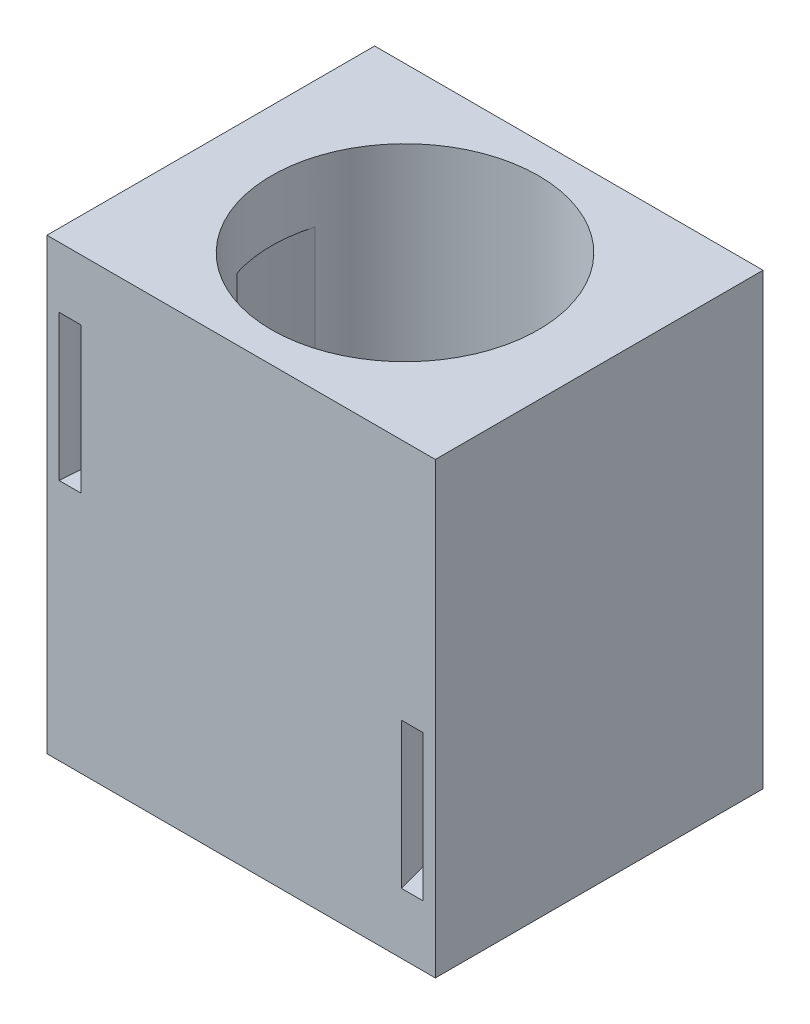
from build123d import *

# Parameters (mm, degrees)
SKETCH1_W           = 32
SKETCH1_H           = 27
SKETCH1_R           = 11
BOSS_EXTRUDE1_DEPTH = 30
CUT_EXTRUDE2_DEPTH  = 12
CIRPATTERN2_COUNT   = 2
SKETCH7_W           = 32
SKETCH7_H           = 27
SKETCH7_R           = 11
BOSS_EXTRUDE2_DEPTH = 3.5
BOSS_EXTRUDE3_START = 3.5
SKETCH8_W           = 32
SKETCH8_H           = 27
SKETCH8_R           = 11
BOSS_EXTRUDE3_DEPTH = 3.5


with BuildPart() as part:
    # Sketch1 → Boss-Extrude1 (new body)
    with BuildSketch(Plane(origin=(0, 0, 0), x_dir=(1, 0, 0), z_dir=(0, 1, 0))):
        Rectangle(SKETCH1_W, SKETCH1_H)
        Circle(SKETCH1_R, mode=Mode.SUBTRACT)
    extrude(amount=BOSS_EXTRUDE1_DEPTH)

    # Sketch4 → Cut-Extrude2 (cut)
    with BuildSketch(Plane(origin=(0, 28.5, 0), x_dir=(1, 0, 0), z_dir=(0, 1, 0))):
        with BuildLine():
            Line((-13.2, -13.5), (-8.943538475, 2.314781316))
            Line((-8.943538475, 2.314781316), (-10.541084547, 3.144127315))
            ThreePointArc((-10.541084547, 3.144127315), (-13.677421735, -4.934985855), (-15, -13.5))
            Line((-15, -13.5), (-13.2, -13.5))
        make_face()
    cut_extrude2 = extrude(amount=-CUT_EXTRUDE2_DEPTH, mode=Mode.SUBTRACT)

    # CirPattern2: Cut-Extrude2 ×2 about axis
    cirpattern2_axis = Axis((0, 15, 28.768716551), (0, 0, -1))
    for i in range(1, CIRPATTERN2_COUNT):
        add(cut_extrude2.rotate(cirpattern2_axis, i * 360 / CIRPATTERN2_COUNT), mode=Mode.SUBTRACT)

    # Sketch7 → Boss-Extrude2 (add)
    with BuildSketch(Plane(origin=(0, 30, 0), x_dir=(1, 0, 0), z_dir=(0, 1, 0))):
        Rectangle(SKETCH7_W, SKETCH7_H)
        Circle(SKETCH7_R, mode=Mode.SUBTRACT)
    extrude(amount=BOSS_EXTRUDE2_DEPTH)

    # Sketch8 → Boss-Extrude3 (add)
    with BuildSketch(Plane.XZ.offset(BOSS_EXTRUDE3_START)):
        Rectangle(SKETCH8_W, SKETCH8_H)
        Circle(SKETCH8_R, mode=Mode.SUBTRACT)
    extrude(amount=-BOSS_EXTRUDE3_DEPTH)


solid = part.part
